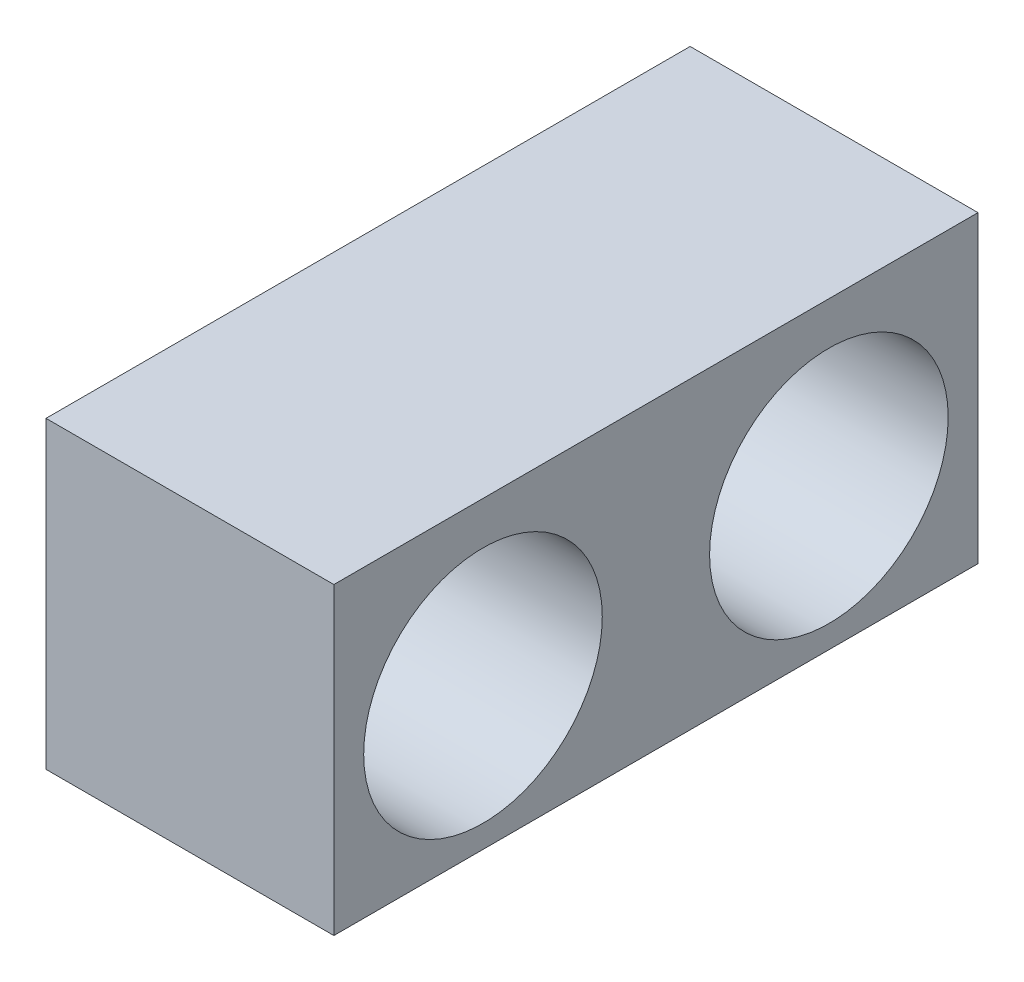
from build123d import *

# Parameters (mm, degrees)
SKETCH1_R           = 75
BOSS_EXTRUDE1_DEPTH = 100
SKETCH2_OUTSIDE_W   = 198.904
SKETCH2_OUTSIDE_H   = 198.904
SKETCH2_OUTSIDE_W_2 = 44.4
SKETCH2_OUTSIDE_H_2 = 99.351371604
CUT_EXTRUDE1_DEPTH  = 146.773797371
SKETCH3_W           = 44.4
SKETCH3_H           = 53.109155611
CUT_EXTRUDE2_DEPTH  = 143.70085858
SKETCH4_R           = 18.4
CUT_EXTRUDE3_DEPTH  = 82.472603048


with BuildPart() as part:
    # Sketch1 → Boss-Extrude1 (new body)
    with BuildSketch(Plane(origin=(0, 0, 0), x_dir=(1, 0, 0), z_dir=(0, 1, 0))):
        with Locations(Location((0, 0, 0), (0, 0, 270))):
            Circle(SKETCH1_R)
    extrude(amount=BOSS_EXTRUDE1_DEPTH)

    # Sketch2 outside → Cut-Extrude1 (cut, through all)
    with BuildSketch(Plane(origin=(0, 100, 0), x_dir=(1, 0, 0), z_dir=(0, 1, 0))):
        Rectangle(SKETCH2_OUTSIDE_W, SKETCH2_OUTSIDE_H)
        Rectangle(SKETCH2_OUTSIDE_W_2, SKETCH2_OUTSIDE_H_2, mode=Mode.SUBTRACT)
    extrude(amount=-CUT_EXTRUDE1_DEPTH, mode=Mode.SUBTRACT)

    # Sketch3 → Cut-Extrude2 (cut, through all)
    with BuildSketch(Plane.XY.offset(49.675685802)):
        with Locations((0, 73.445422194)):
            Rectangle(SKETCH3_W, SKETCH3_H)
    extrude(amount=-CUT_EXTRUDE2_DEPTH, mode=Mode.SUBTRACT)

    # Sketch4 → Cut-Extrude3 (cut, through all)
    with BuildSketch(Plane.ZY.offset(22.2)):
        with Locations((26.675685802, 21.890844389)):
            Circle(SKETCH4_R)
        with Locations((-26.675685802, 21.890844389)):
            Circle(SKETCH4_R)
    extrude(amount=-CUT_EXTRUDE3_DEPTH, mode=Mode.SUBTRACT)


solid = part.part
